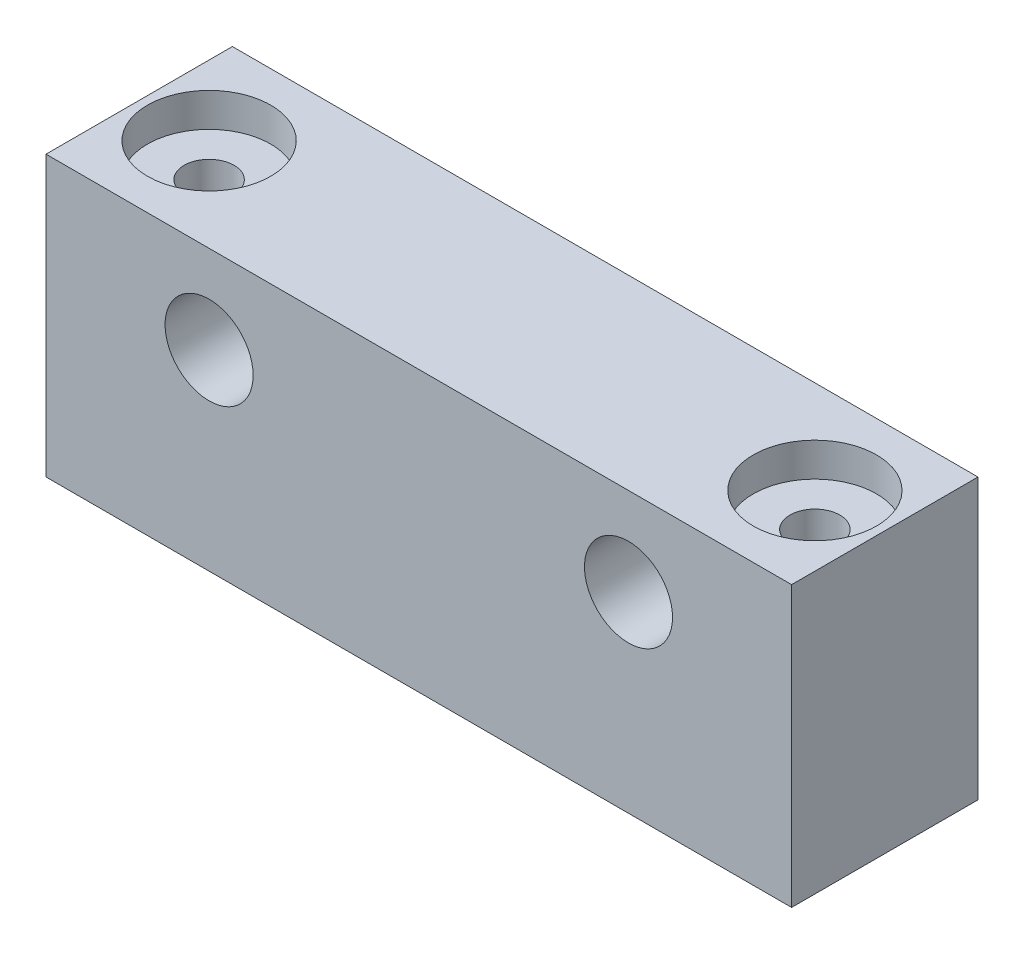
from build123d import *

# Parameters (mm, degrees)
SKETCH1_W                                        = 50.8
SKETCH1_H                                        = 19.05
SKETCH1_R                                        = 3
BOSS_EXTRUDE1_DEPTH                              = 12.7
CBORE_FOR_M3_HEX_HEAD_MACHINE_SCREW1_D           = 3.4
CBORE_FOR_M3_HEX_HEAD_MACHINE_SCREW1_CBORE_D     = 8.4
CBORE_FOR_M3_HEX_HEAD_MACHINE_SCREW1_CBORE_DEPTH = 2.3


with BuildPart() as part:
    # Sketch1 → Boss-Extrude1 (new body)
    with BuildSketch(Plane.XY):
        Rectangle(SKETCH1_W, SKETCH1_H)
        with Locations((-14.2875, 3.525)):
            Circle(SKETCH1_R, mode=Mode.SUBTRACT)
        with Locations((14.2875, 3.525)):
            Circle(SKETCH1_R, mode=Mode.SUBTRACT)
    extrude(amount=BOSS_EXTRUDE1_DEPTH)

    # CBORE for M3 Hex Head Machine Screw1 (through all)
    with Locations(Plane(origin=(0, 9.525, 0), x_dir=(1, 0, 0), z_dir=(0, 1, 0))):
        with Locations((-20.6375, -6.35), (20.6375, -6.35)):
            CounterBoreHole(CBORE_FOR_M3_HEX_HEAD_MACHINE_SCREW1_D / 2, CBORE_FOR_M3_HEX_HEAD_MACHINE_SCREW1_CBORE_D / 2, CBORE_FOR_M3_HEX_HEAD_MACHINE_SCREW1_CBORE_DEPTH)


solid = part.part
